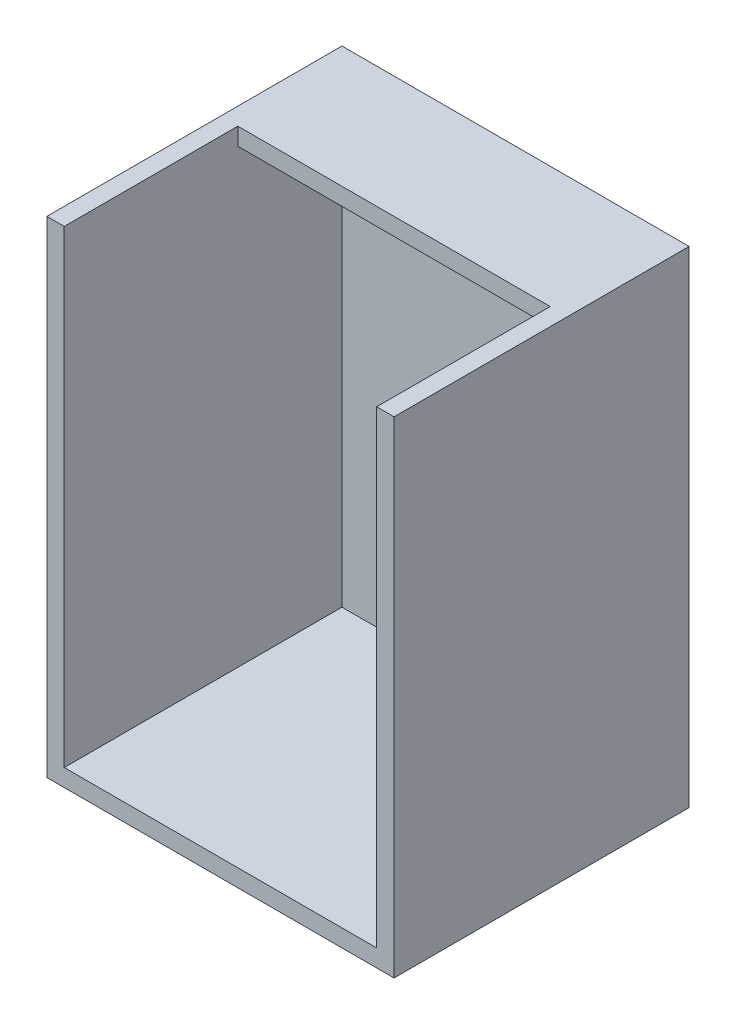
from build123d import *

# Parameters (mm, degrees)
SKETCH2_W           = 140
SKETCH2_H           = 100
BOSS_EXTRUDE1_DEPTH = 5
SKETCH3_W           = 100
SKETCH3_H           = 140
SKETCH3_W_2         = 90
SKETCH3_H_2         = 130
BOSS_EXTRUDE2_DEPTH = 30
BOSS_EXTRUDE3_START = 35
BOSS_EXTRUDE3_DEPTH = 50


with BuildPart() as part:
    # Sketch2 → Boss-Extrude1 (new body)
    with BuildSketch(Plane(origin=(0, 0, 0), x_dir=(0, 1, 0), z_dir=(0, 0, 1))):
        Rectangle(SKETCH2_W, SKETCH2_H)
    extrude(amount=BOSS_EXTRUDE1_DEPTH)

    # Sketch3 → Boss-Extrude2 (add)
    with BuildSketch(Plane.XY.offset(5)):
        Rectangle(SKETCH3_W, SKETCH3_H)
        Rectangle(SKETCH3_W_2, SKETCH3_H_2, mode=Mode.SUBTRACT)
    extrude(amount=BOSS_EXTRUDE2_DEPTH)

    # Sketch4 → Boss-Extrude3 (add)
    with BuildSketch(Plane(origin=(0, 0, 0), x_dir=(0, 1, 0), z_dir=(0, 0, 1)).offset(BOSS_EXTRUDE3_START)):
        Polygon((70, 50), (-70, 50), (-70, -50), (70, -50), (70, -45), (-65, -45), (-65, 45), (70, 45), align=None)
    extrude(amount=BOSS_EXTRUDE3_DEPTH)


solid = part.part
